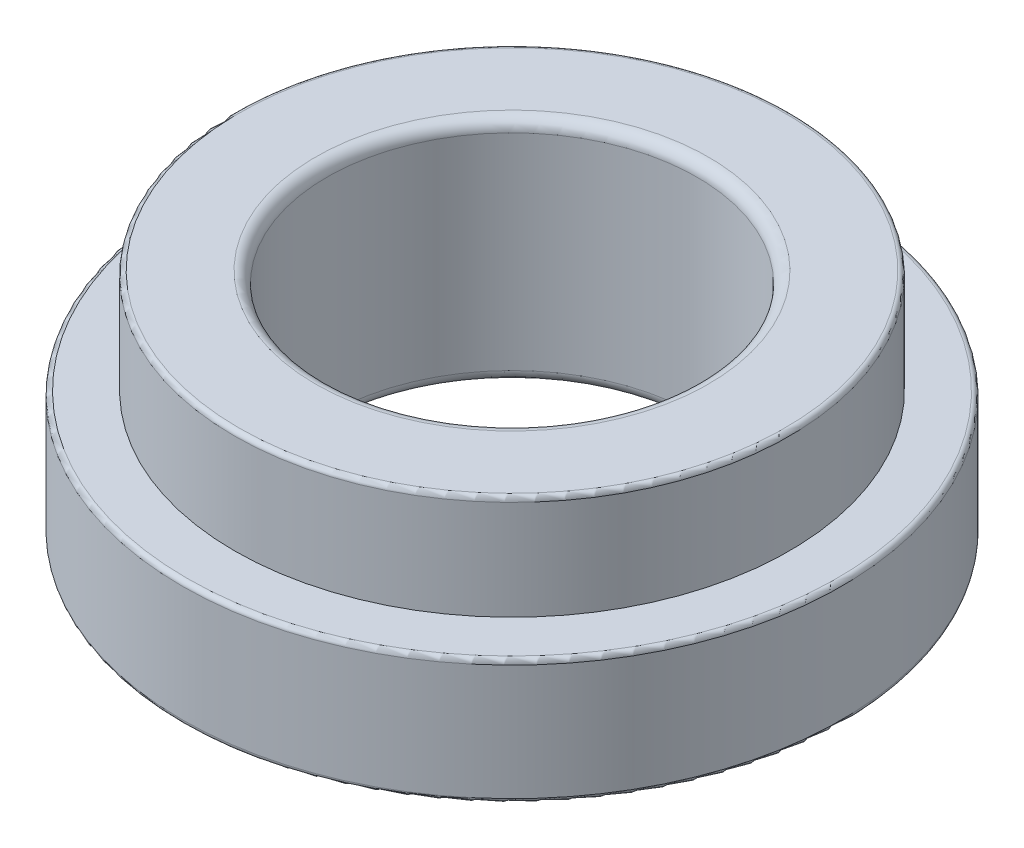
from build123d import *

# Parameters (mm, degrees)
SKETCH1_R           = 7.125
BOSS_EXTRUDE1_DEPTH = 4.95
SKETCH2_R           = 4
CUT_EXTRUDE2_DEPTH  = 12.25
CUT_EXTRUDE3_START  = -2.25
SKETCH3_R           = 7.125
SKETCH3_R_2         = 5.998819533
CUT_EXTRUDE3_DEPTH  = 2.25
FILLET1_R           = 0.1
FILLET2_R           = 0.25


with BuildPart() as part:
    # Sketch1 → Boss-Extrude1 (new body)
    with BuildSketch(Plane(origin=(0, 0, 0), x_dir=(1, 0, 0), z_dir=(0, 1, 0))):
        with Locations(Location((0, 0, 0), (0, 0, 90))):
            Circle(SKETCH1_R)
    extrude(amount=BOSS_EXTRUDE1_DEPTH)

    # Sketch2 → Cut-Extrude2 (cut)
    with BuildSketch(Plane(origin=(0, 4.95, 0), x_dir=(1, 0, 0), z_dir=(0, 1, 0))):
        with Locations(Location((0, 0, 0), (0, 0, 270))):
            Circle(SKETCH2_R)
    extrude(amount=-CUT_EXTRUDE2_DEPTH, mode=Mode.SUBTRACT)

    # Sketch3 → Cut-Extrude3 (cut)
    with BuildSketch(Plane(origin=(0, 4.95, 0), x_dir=(1, 0, 0), z_dir=(0, 1, 0)).offset(CUT_EXTRUDE3_START)):
        with Locations(Location((0, 0, 0), (0, 0, 90))):
            Circle(SKETCH3_R)
        with Locations(Location((0, 0, 0), (0, 0, 270))):
            Circle(SKETCH3_R_2, mode=Mode.SUBTRACT)
    extrude(amount=CUT_EXTRUDE3_DEPTH, mode=Mode.SUBTRACT)

    # Fillet1
    fillet1_edges = [part.edges().sort_by_distance(p)[0] for p in [
        (0, 2.7, 7.125),
        (0, 4.95, -5.998819533),
        (0, 0, 7.125),
    ]]
    fillet(fillet1_edges, radius=FILLET1_R)

    # Fillet2
    fillet2_edges = [part.edges().sort_by_distance(p)[0] for p in [
        (0, 0, -4),
        (0, 4.95, -4),
    ]]
    fillet(fillet2_edges, radius=FILLET2_R)


solid = part.part
